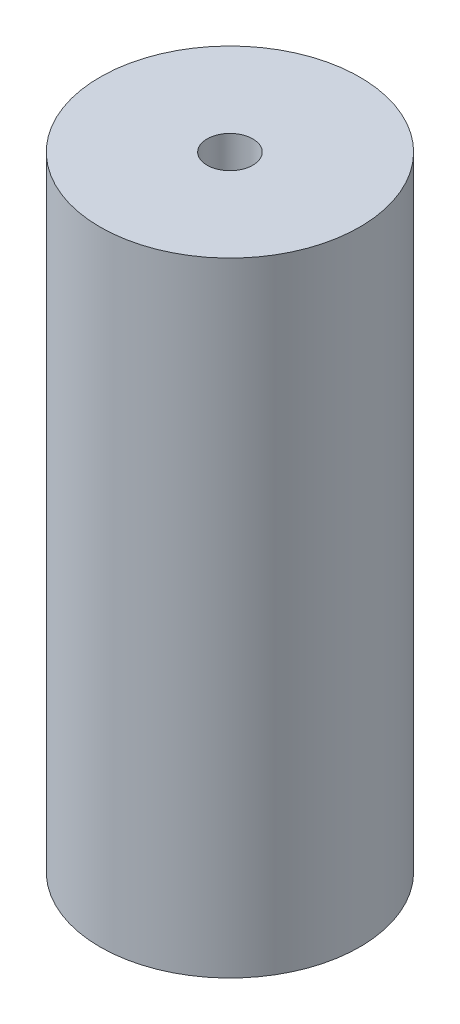
from build123d import *

# Parameters (mm, degrees)
ESQUISSE1_R             = 12.5
BOSS_EXTRU_1_DEPTH      = 60
ESQUISSE2_R             = 2.2
ENL_V_MAT_EXTRU_1_DEPTH = 60


with BuildPart() as part:
    # Esquisse1 → Boss.-Extru.1 (new body)
    with BuildSketch(Plane(origin=(0, 0, 0), x_dir=(1, 0, 0), z_dir=(0, 1, 0))):
        with Locations(Location((0, 0, 0), (0, 0, 270))):
            Circle(ESQUISSE1_R)
    extrude(amount=BOSS_EXTRU_1_DEPTH)

    # Esquisse2 → Enlèv. mat.-Extru.1 (cut)
    with BuildSketch(Plane.XZ):
        with Locations(Location((0, 0, 0), (0, 0, 270))):
            Circle(ESQUISSE2_R)
    extrude(amount=-ENL_V_MAT_EXTRU_1_DEPTH, mode=Mode.SUBTRACT)


solid = part.part
